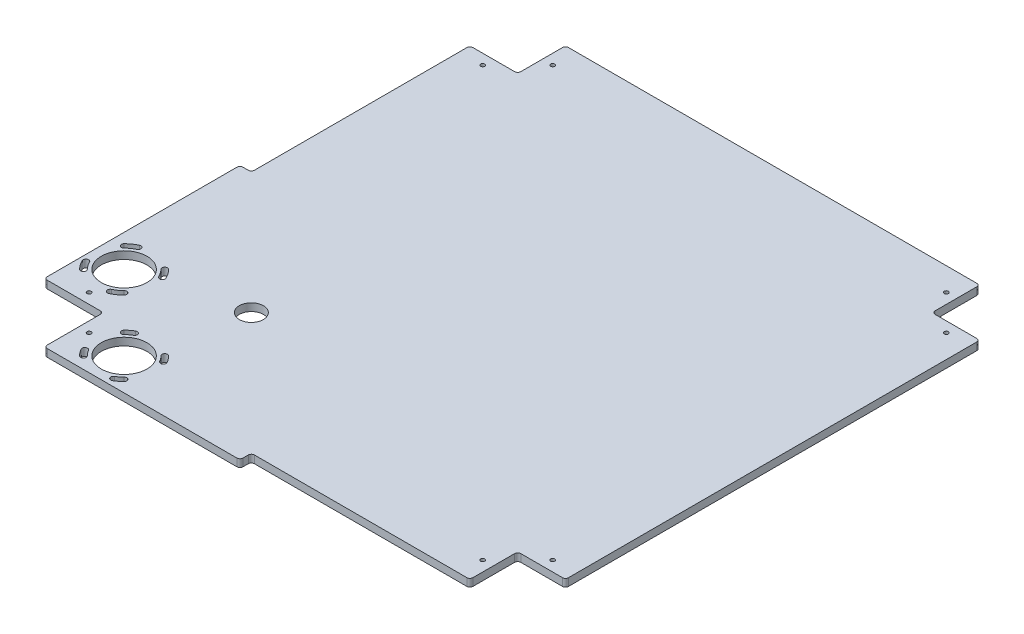
from build123d import *

# Parameters (mm, degrees)
BOSS_EXTRUDE1_DEPTH  = 6.35
SKETCH2_R            = 10.033
CUT_EXTRUDE1_DEPTH   = 9.525
SKETCH3_W            = 39.878
SKETCH3_H            = 39.878
SKETCH3_W_2          = 51.829351428
SKETCH3_H_2          = 50.992938467
CUT_EXTRUDE2_DEPTH   = 315.37310238
FILLET1_R            = 2.54
M3_CLEARANCE_HOLE1_D = 3.4
SKETCH6_R            = 19.05
CUT_EXTRUDE3_DEPTH   = 315.37310238


with BuildPart() as part:
    # Sketch1 → Boss-Extrude1 (new body)
    with BuildSketch(Plane(origin=(0, 0, 0), x_dir=(1, 0, 0), z_dir=(0, 1, 0))):
        Polygon((212.725, -212.725), (212.725, 212.725), (-212.725, 212.725), (-212.725, -9.525), (-222.25, -9.525), (-222.25, -222.25), (-9.525, -222.25), (-9.525, -212.725), align=None)
    extrude(amount=BOSS_EXTRUDE1_DEPTH)

    # Sketch2 → Cut-Extrude1 (cut)
    with BuildSketch(Plane(origin=(0, 6.35, 0), x_dir=(1, 0, 0), z_dir=(0, 1, 0))):
        with Locations(Location((-111.125, -111.125, 0), (0, 0, 270))):
            Circle(SKETCH2_R)
    extrude(amount=-CUT_EXTRUDE1_DEPTH, mode=Mode.SUBTRACT)

    # Sketch3 → Cut-Extrude2 (cut, through all)
    with BuildSketch(Plane(origin=(0, 6.35, 0), x_dir=(1, 0, 0), z_dir=(0, 1, 0))):
        with Locations((-192.786, 192.786)):
            Rectangle(SKETCH3_W, SKETCH3_H)
        with Locations((192.786, 192.786)):
            Rectangle(SKETCH3_W, SKETCH3_H)
        with Locations((192.786, -192.786)):
            Rectangle(SKETCH3_W, SKETCH3_H)
        with Locations((-198.761675714, -198.343469234)):
            Rectangle(SKETCH3_W_2, SKETCH3_H_2)
    extrude(amount=-CUT_EXTRUDE2_DEPTH, mode=Mode.SUBTRACT)

    # Fillet1
    fillet1_edges = [part.edges().sort_by_distance(p)[0] for p in [
        (-9.525, 3.175, 212.725),
        (-9.525, 3.175, 222.25),
        (-222.25, 3.175, 9.525),
        (-212.725, 3.175, 9.525),
        (-212.725, 3.175, -172.847),
        (-172.847, 3.175, -212.725),
        (-172.847, 3.175, -172.847),
        (212.725, 3.175, -172.847),
        (172.847, 3.175, -172.847),
        (172.847, 3.175, -212.725),
        (212.725, 3.175, 172.847),
        (172.847, 3.175, 212.725),
        (172.847, 3.175, 172.847),
        (-172.847, 3.175, 222.25),
        (-172.847, 3.175, 172.847),
        (-222.25, 3.175, 172.847),
    ]]
    fillet(fillet1_edges, radius=FILLET1_R)

    # M3 Clearance Hole1 (through all)
    with Locations(Plane(origin=(0, 6.35, 0), x_dir=(1, 0, 0), z_dir=(0, 1, 0))):
        with Locations((-164.211, -193.421), (-193.421, -164.211), (-193.421, 164.211), (-164.211, 193.421), (164.211, 193.421), (193.421, 164.211), (193.421, -164.211), (164.211, -193.421)):
            Hole(M3_CLEARANCE_HOLE1_D / 2)

    # Sketch6 → Cut-Extrude3 (cut, through all)
    with BuildSketch(Plane(origin=(0, 6.35, 0), x_dir=(1, 0, 0), z_dir=(0, 1, 0))):
        with Locations(Location((-195.453, -132.969, 0), (0, 0, 270))):
            Circle(SKETCH6_R)
        with Locations(Location((-132.969, -195.453, 0), (0, 0, 270))):
            Circle(SKETCH6_R)
        with BuildLine():
            ThreePointArc((-184.342788517, -156.794925413), (-180.374249065, -154.503688092), (-176.863869829, -151.558130171))
            ThreePointArc((-176.863869829, -151.558130171), (-176.863869829, -148.325237967), (-180.096762033, -148.325237967))
            ThreePointArc((-180.096762033, -148.325237967), (-182.996640532, -150.758524946), (-186.27499921, -152.651286211))
            ThreePointArc((-186.27499921, -152.651286211), (-187.380713465, -155.689211159), (-184.342788517, -156.794925413))
        make_face()
        with BuildLine():
            ThreePointArc((-110.20205816, -182.3085), (-112.112534037, -179.449270793), (-114.379869829, -176.863869829))
            ThreePointArc((-114.379869829, -176.863869829), (-117.612762033, -176.863869829), (-117.612762033, -180.096762033))
            ThreePointArc((-117.612762033, -180.096762033), (-115.739745509, -182.232528046), (-114.161526306, -184.5945))
            ThreePointArc((-114.161526306, -184.5945), (-111.038792233, -185.431234073), (-110.20205816, -182.3085))
        make_face()
        with BuildLine():
            ThreePointArc((-219.278925413, -144.079211483), (-216.987688092, -148.047750935), (-214.042130171, -151.558130171))
            ThreePointArc((-214.042130171, -151.558130171), (-210.809237967, -151.558130171), (-210.809237967, -148.325237967))
            ThreePointArc((-210.809237967, -148.325237967), (-213.242524946, -145.425359468), (-215.135286211, -142.14700079))
            ThreePointArc((-215.135286211, -142.14700079), (-218.173211159, -141.041286535), (-219.278925413, -144.079211483))
        make_face()
        with BuildLine():
            ThreePointArc((-206.563211483, -109.143074587), (-210.531750935, -111.434311908), (-214.042130171, -114.379869829))
            ThreePointArc((-214.042130171, -114.379869829), (-214.042130171, -117.612762033), (-210.809237967, -117.612762033))
            ThreePointArc((-210.809237967, -117.612762033), (-207.909359468, -115.179475054), (-204.63100079, -113.286713789))
            ThreePointArc((-204.63100079, -113.286713789), (-203.525286535, -110.248788841), (-206.563211483, -109.143074587))
        make_face()
        with BuildLine():
            ThreePointArc((-171.627074587, -121.858788517), (-173.918311908, -117.890249065), (-176.863869829, -114.379869829))
            ThreePointArc((-176.863869829, -114.379869829), (-180.096762033, -114.379869829), (-180.096762033, -117.612762033))
            ThreePointArc((-180.096762033, -117.612762033), (-177.663475054, -120.512640532), (-175.770713789, -123.79099921))
            ThreePointArc((-175.770713789, -123.79099921), (-172.732788841, -124.896713465), (-171.627074587, -121.858788517))
        make_face()
        with BuildLine():
            ThreePointArc((-119.8245, -218.21994184), (-116.965270793, -216.309465963), (-114.379869829, -214.042130171))
            ThreePointArc((-114.379869829, -214.042130171), (-114.379869829, -210.809237967), (-117.612762033, -210.809237967))
            ThreePointArc((-117.612762033, -210.809237967), (-119.748528046, -212.682254491), (-122.1105, -214.260473694))
            ThreePointArc((-122.1105, -214.260473694), (-122.947234073, -217.383207767), (-119.8245, -218.21994184))
        make_face()
        with BuildLine():
            ThreePointArc((-155.73594184, -208.5975), (-153.825465963, -211.456729207), (-151.558130171, -214.042130171))
            ThreePointArc((-151.558130171, -214.042130171), (-148.325237967, -214.042130171), (-148.325237967, -210.809237967))
            ThreePointArc((-148.325237967, -210.809237967), (-150.198254491, -208.673471954), (-151.776473694, -206.3115))
            ThreePointArc((-151.776473694, -206.3115), (-154.899207767, -205.474765927), (-155.73594184, -208.5975))
        make_face()
        with BuildLine():
            ThreePointArc((-146.1135, -172.68605816), (-148.972729207, -174.596534037), (-151.558130171, -176.863869829))
            ThreePointArc((-151.558130171, -176.863869829), (-151.558130171, -180.096762033), (-148.325237967, -180.096762033))
            ThreePointArc((-148.325237967, -180.096762033), (-146.189471954, -178.223745509), (-143.8275, -176.645526306))
            ThreePointArc((-143.8275, -176.645526306), (-142.990765927, -173.522792233), (-146.1135, -172.68605816))
        make_face()
    extrude(amount=-CUT_EXTRUDE3_DEPTH, mode=Mode.SUBTRACT)


solid = part.part
